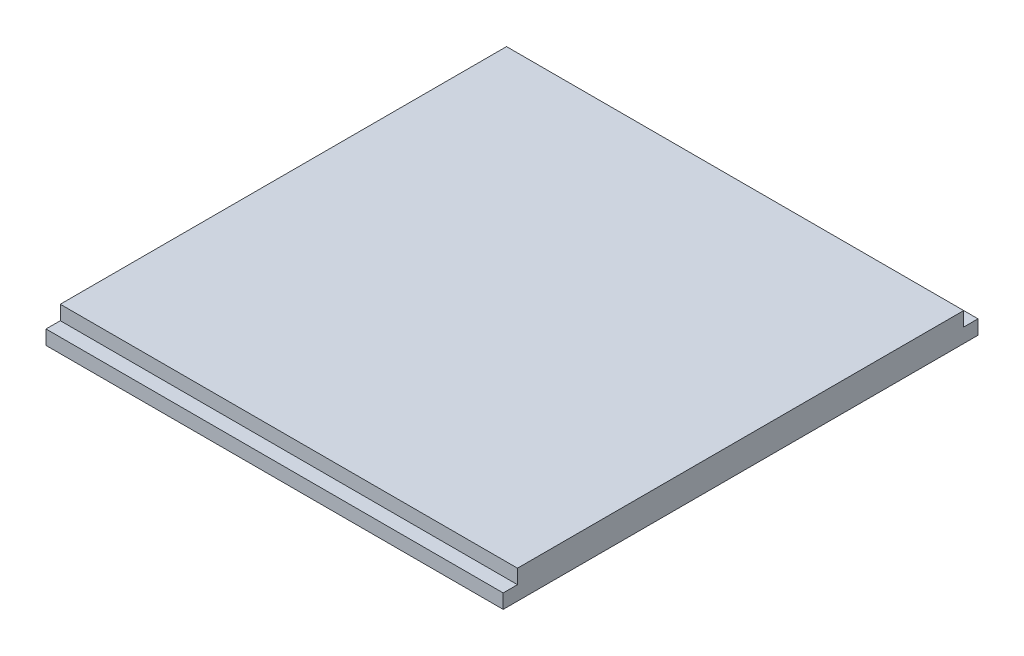
from build123d import *

# Parameters (mm, degrees)
SKETCH1_W           = 1920
SKETCH1_H           = 1994
BOSS_EXTRUDE1_DEPTH = 120
SKETCH2_W           = 60
SKETCH2_H           = 60
CUT_EXTRUDE1_DEPTH  = 2167.750793239


with BuildPart() as part:
    # Sketch1 → Boss-Extrude1 (new body)
    with BuildSketch(Plane(origin=(0, 0, 0), x_dir=(1, 0, 0), z_dir=(0, 1, 0))):
        Rectangle(SKETCH1_W, SKETCH1_H)
    extrude(amount=BOSS_EXTRUDE1_DEPTH)

    # Sketch2 → Cut-Extrude1 (cut, through all)
    with BuildSketch(Plane.ZY.offset(960)):
        with Locations((-967, 90)):
            Rectangle(SKETCH2_W, SKETCH2_H)
        with Locations((967, 90)):
            Rectangle(SKETCH2_W, SKETCH2_H)
    extrude(amount=-CUT_EXTRUDE1_DEPTH, mode=Mode.SUBTRACT)


solid = part.part
